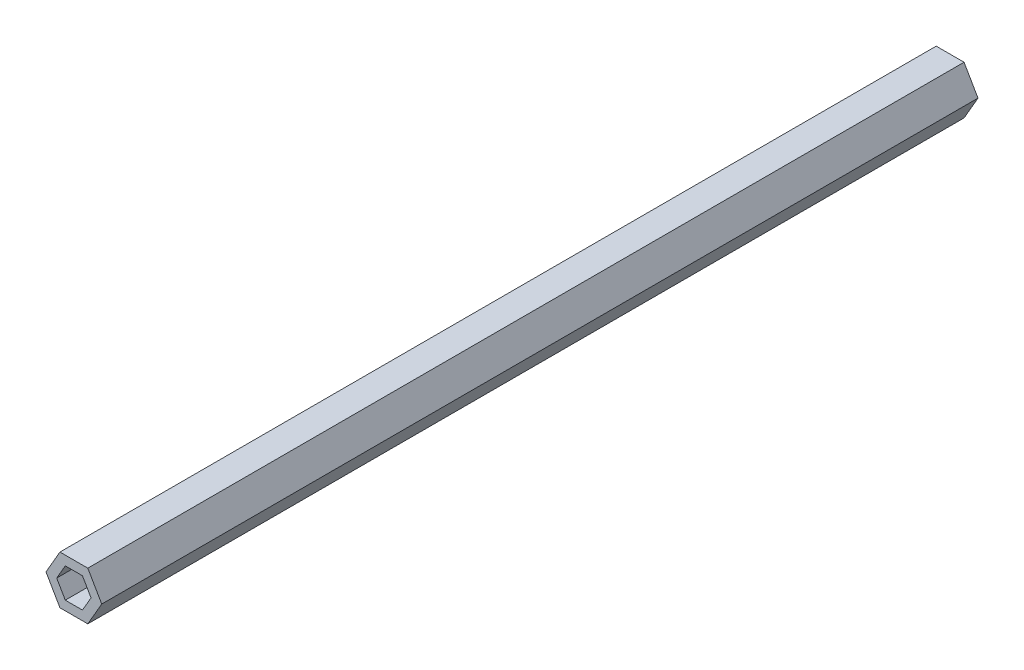
from build123d import *

# Parameters (mm, degrees)
BOSS_EXTRUDE1_DEPTH = 179.705
CUT_EXTRUDE1_DEPTH  = 6.35
CUT_EXTRUDE2_DEPTH  = 6.35


with BuildPart() as part:
    # Sketch1 → Boss-Extrude1 (new body)
    with BuildSketch(Plane.XY):
        Polygon((5.715, 0), (2.8575, 4.949335183), (-2.8575, 4.949335183), (-5.715, 0), (-2.8575, -4.949335183), (2.8575, -4.949335183), align=None)
    extrude(amount=BOSS_EXTRUDE1_DEPTH)

    # Sketch2 → Cut-Extrude1 (cut)
    with BuildSketch(Plane.XY.offset(179.705)):
        Polygon((3.521836637, 0), (1.760918319, 3.049999996), (-1.760918319, 3.049999996), (-3.521836637, 0), (-1.760918319, -3.049999996), (1.760918319, -3.049999996), align=None)
    extrude(amount=-CUT_EXTRUDE1_DEPTH, mode=Mode.SUBTRACT)

    # Sketch3 → Cut-Extrude2 (cut)
    with BuildSketch(Plane(origin=(0, 0, 0), x_dir=(-1, 0, 0), z_dir=(0, 0, -1))):
        Polygon((1.760918319, 3.049999996), (-1.760918319, 3.049999996), (-3.521836637, 0), (-1.760918319, -3.049999996), (1.760918319, -3.049999996), (3.521836637, 0), align=None)
    extrude(amount=-CUT_EXTRUDE2_DEPTH, mode=Mode.SUBTRACT)


solid = part.part
